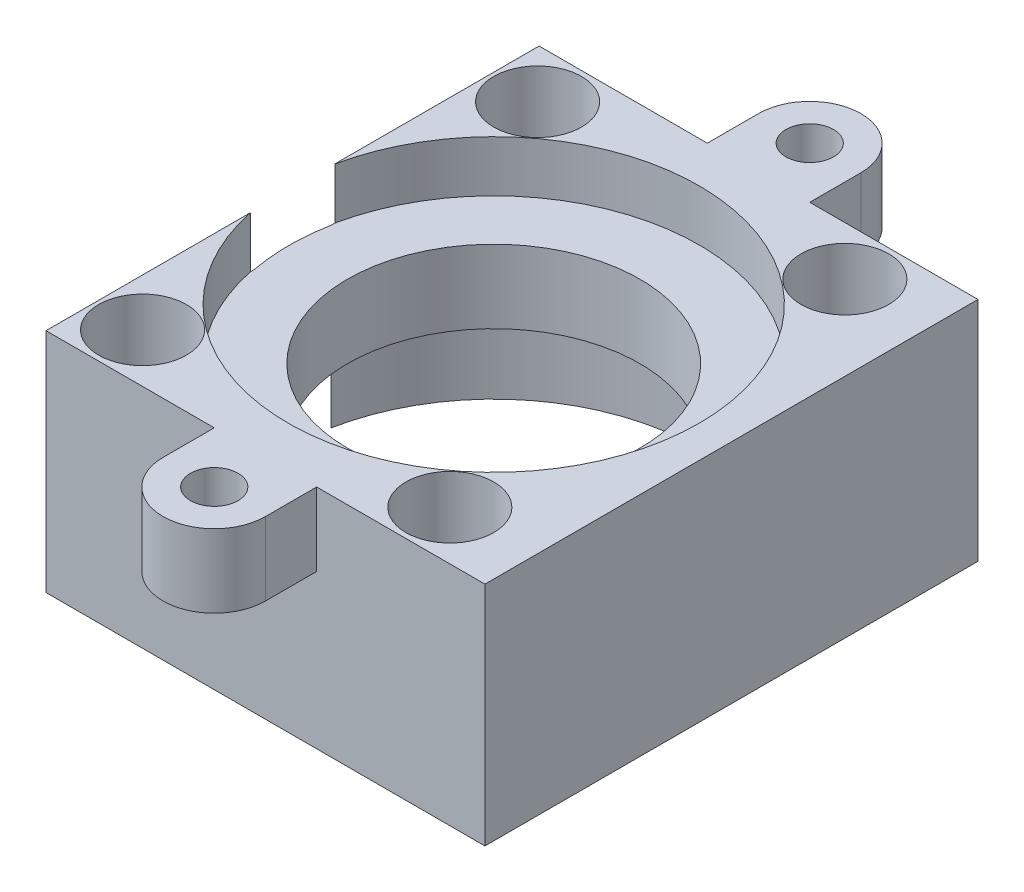
from build123d import *

# Parameters (mm, degrees)
SKETCH1_R           = 1.375
SKETCH1_R_2         = 1.460845326
SKETCH1_R_3         = 1.480655282
BOSS_EXTRUDE1_DEPTH = 15
BOSS_EXTRUDE2_START = -8
SKETCH2_R           = 14
SKETCH2_R_2         = 10
BOSS_EXTRUDE2_DEPTH = 8
CUT_EXTRUDE1_START  = -3
SKETCH3_R           = 14
SKETCH3_R_2         = 10
CUT_EXTRUDE1_DEPTH  = 3
SKETCH5_R           = 1.480655282
SKETCH5_R_2         = 1.375
SKETCH5_R_3         = 1.460845326
BOSS_EXTRUDE3_DEPTH = 0.5
BOSS_EXTRUDE4_DEPTH = 5
SKETCH7_R           = 3
CUT_EXTRUDE2_DEPTH  = 12.5
SKETCH8_R           = 14.05
CUT_EXTRUDE3_DEPTH  = 3.5


with BuildPart() as part:
    # Sketch1 → Boss-Extrude1 (new body)
    with BuildSketch(Plane(origin=(0, 0, 0), x_dir=(1, 0, 0), z_dir=(0, 1, 0))):
        with BuildLine():
            Line((-15, -16.85), (15, -16.85))
            Line((15, -16.85), (15, 16.85))
            Line((15, 16.85), (-15, 16.85))
            Line((-15, 16.85), (-15, 2.633913438))
            ThreePointArc((-15, 2.633913438), (0.072875656, 13.937359865), (12.75, 0))
            ThreePointArc((12.75, 0), (0.072875656, -13.937359865), (-15, -2.633913438))
            Line((-15, -2.633913438), (-15, -16.85))
        make_face()
        with Locations(Location((-11.75, -13.5, 0), (0, 0, 270))):
            Circle(SKETCH1_R, mode=Mode.SUBTRACT)
        with Locations(Location((9.25, -13.5, 0), (0, 0, 270))):
            Circle(SKETCH1_R_2, mode=Mode.SUBTRACT)
        with Locations(Location((-11.75, 13.5, 0), (0, 0, 270))):
            Circle(SKETCH1_R, mode=Mode.SUBTRACT)
        with Locations(Location((9.25, 13.5, 0), (0, 0, 270))):
            Circle(SKETCH1_R_3, mode=Mode.SUBTRACT)
    extrude(amount=BOSS_EXTRUDE1_DEPTH)

    # Sketch2 → Boss-Extrude2 (add)
    with BuildSketch(Plane(origin=(0, 15, 0), x_dir=(1, 0, 0), z_dir=(0, 1, 0)).offset(BOSS_EXTRUDE2_START)):
        with Locations((-1.25, 0)):
            Circle(SKETCH2_R)
        with Locations(Location((-1.25, 0, 0), (0, 0, 270))):
            Circle(SKETCH2_R_2, mode=Mode.SUBTRACT)
    extrude(amount=BOSS_EXTRUDE2_DEPTH)

    # Sketch3 → Cut-Extrude1 (cut)
    with BuildSketch(Plane(origin=(0, 15, 0), x_dir=(1, 0, 0), z_dir=(0, 1, 0)).offset(CUT_EXTRUDE1_START)):
        with Locations((-1.25, 0)):
            Circle(SKETCH3_R)
        with Locations(Location((-1.25, 0, 0), (0, 0, 270))):
            Circle(SKETCH3_R_2, mode=Mode.SUBTRACT)
    extrude(amount=CUT_EXTRUDE1_DEPTH, mode=Mode.SUBTRACT)

    # Sketch5 → Boss-Extrude3 (add)
    with BuildSketch(Plane(origin=(0, 15, 0), x_dir=(1, 0, 0), z_dir=(0, 1, 0))):
        with BuildLine():
            Line((-15, 16.85), (-15, 2.633913438))
            ThreePointArc((-15, 2.633913438), (12.75, 0), (-15, -2.633913438))
            Line((-15, -2.633913438), (-15, -16.85))
            Line((-15, -16.85), (15, -16.85))
            Line((15, -16.85), (15, 16.85))
            Line((15, 16.85), (-15, 16.85))
        make_face()
        with Locations(Location((9.25, 13.5, 0), (0, 0, 270))):
            Circle(SKETCH5_R, mode=Mode.SUBTRACT)
        with Locations(Location((-11.75, -13.5, 0), (0, 0, 270))):
            Circle(SKETCH5_R_2, mode=Mode.SUBTRACT)
        with Locations(Location((-11.75, 13.5, 0), (0, 0, 270))):
            Circle(SKETCH5_R_2, mode=Mode.SUBTRACT)
        with Locations(Location((9.25, -13.5, 0), (0, 0, 270))):
            Circle(SKETCH5_R_3, mode=Mode.SUBTRACT)
    extrude(amount=BOSS_EXTRUDE3_DEPTH)

    # Sketch6 → Boss-Extrude4 (add)
    with BuildSketch(Plane(origin=(0, 15.5, 0), x_dir=(1, 0, 0), z_dir=(0, 1, 0))):
        with BuildLine():
            ThreePointArc((-1.625, 20.35), (0, 21.975), (1.625, 20.35))
            Line((1.625, 20.35), (3.5, 20.35))
            ThreePointArc((3.5, 20.35), (0, 23.85), (-3.5, 20.35))
            Line((-3.5, 20.35), (-1.625, 20.35))
        make_face()
        with BuildLine():
            Line((3.5, 20.35), (1.625, 20.35))
            ThreePointArc((1.625, 20.35), (0, 18.725), (-1.625, 20.35))
            Line((-1.625, 20.35), (-3.5, 20.35))
            ThreePointArc((-3.5, 20.35), (-2.474873743, 17.875126275), (-2.6e-08, 16.85))
            ThreePointArc((-2.6e-08, 16.85), (2.474873725, 17.875126257), (3.5, 20.35))
        make_face()
        with BuildLine():
            Line((3.5, 16.85), (3.5, 20.35))
            ThreePointArc((3.5, 20.35), (2.474873725, 17.875126257), (-2.6e-08, 16.85))
            Line((-2.6e-08, 16.85), (3.5, 16.85))
        make_face()
        with BuildLine():
            ThreePointArc((-2.6e-08, 16.85), (-2.474873743, 17.875126275), (-3.5, 20.35))
            Line((-3.5, 20.35), (-3.5, 16.85))
            Line((-3.5, 16.85), (-2.6e-08, 16.85))
        make_face()
        with BuildLine():
            ThreePointArc((-3.5, -20.35), (-2.474873734, -17.875126266), (0, -16.85))
            Line((0, -16.85), (-3.5, -16.85))
            Line((-3.5, -16.85), (-3.5, -20.35))
        make_face()
        with BuildLine():
            Line((3.5, -20.35), (3.5, -16.85))
            Line((3.5, -16.85), (0, -16.85))
            ThreePointArc((0, -16.85), (2.474873734, -17.875126266), (3.5, -20.35))
        make_face()
        with BuildLine():
            ThreePointArc((-3.5, -20.35), (0, -23.85), (3.5, -20.35))
            Line((3.5, -20.35), (1.625, -20.35))
            ThreePointArc((1.625, -20.35), (0, -21.975), (-1.625, -20.35))
            Line((-1.625, -20.35), (-3.5, -20.35))
        make_face()
        with BuildLine():
            Line((1.625, -20.35), (3.5, -20.35))
            ThreePointArc((3.5, -20.35), (2.474873734, -17.875126266), (0, -16.85))
            ThreePointArc((0, -16.85), (-2.474873734, -17.875126266), (-3.5, -20.35))
            Line((-3.5, -20.35), (-1.625, -20.35))
            ThreePointArc((-1.625, -20.35), (0, -18.725), (1.625, -20.35))
        make_face()
    extrude(amount=-BOSS_EXTRUDE4_DEPTH)

    # Sketch7 → Cut-Extrude2 (cut)
    with BuildSketch(Plane(origin=(0, 15.5, 0), x_dir=(1, 0, 0), z_dir=(0, 1, 0))):
        with Locations(Location((-11.75, 13.5, 0), (0, 0, 270))):
            Circle(SKETCH7_R)
        with Locations(Location((9.25, 13.5, 0), (0, 0, 270))):
            Circle(SKETCH7_R)
        with Locations(Location((9.25, -13.5, 0), (0, 0, 270))):
            Circle(SKETCH7_R)
        with Locations(Location((-11.75, -13.5, 0), (0, 0, 270))):
            Circle(SKETCH7_R)
    extrude(amount=-CUT_EXTRUDE2_DEPTH, mode=Mode.SUBTRACT)

    # Sketch8 → Cut-Extrude3 (cut)
    with BuildSketch(Plane(origin=(0, 15.5, 0), x_dir=(1, 0, 0), z_dir=(0, 1, 0))):
        with Locations((-1.25, 0)):
            Circle(SKETCH8_R)
    extrude(amount=-CUT_EXTRUDE3_DEPTH, mode=Mode.SUBTRACT)


solid = part.part
